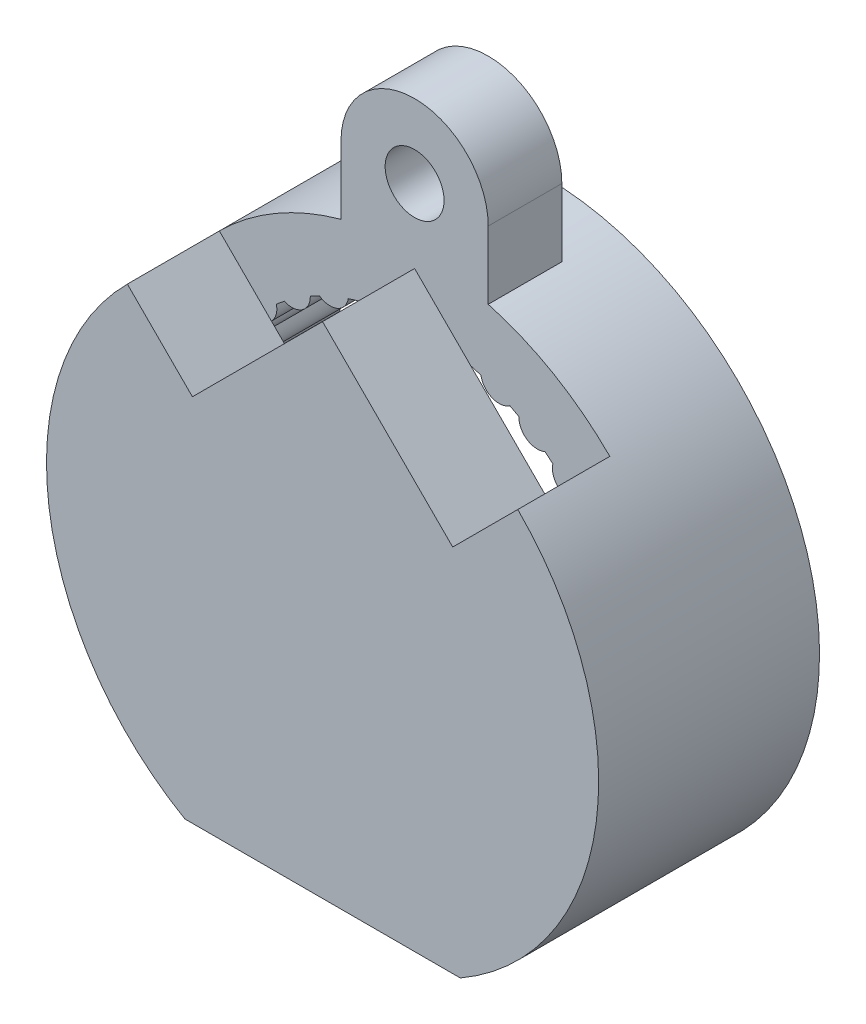
from build123d import *

# Parameters (mm, degrees)
SKETCH1_R               = 1
BOSS_EXTRUDE1_DEPTH     = 3.5
BOSS_EXTRUDE1_2_DEPTH   = 3.5
BOSS_EXTRUDE1_3_DEPTH   = 3.5
BOSS_EXTRUDE1_4_DEPTH   = 3.5
BOSS_EXTRUDE1_5_DEPTH   = 3.5
BOSS_EXTRUDE1_6_DEPTH   = 3.5
BOSS_EXTRUDE1_7_DEPTH   = 3.5
BOSS_EXTRUDE1_8_DEPTH   = 3.5
BOSS_EXTRUDE1_9_DEPTH   = 3.5
BOSS_EXTRUDE1_10_DEPTH  = 3.5
BOSS_EXTRUDE1_11_DEPTH  = 3.5
BOSS_EXTRUDE1_12_DEPTH  = 3.5
BOSS_EXTRUDE1_13_DEPTH  = 3.5
BOSS_EXTRUDE1_14_DEPTH  = 3.5
BOSS_EXTRUDE1_15_DEPTH  = 3.5
BOSS_EXTRUDE1_16_DEPTH  = 3.5
BOSS_EXTRUDE1_17_DEPTH  = 3.5
BOSS_EXTRUDE1_18_DEPTH  = 3.5
BOSS_EXTRUDE1_19_DEPTH  = 3.5
BOSS_EXTRUDE1_20_DEPTH  = 3.5
BOSS_EXTRUDE1_21_DEPTH  = 3.5
BOSS_EXTRUDE1_22_DEPTH  = 3.5
BOSS_EXTRUDE1_23_DEPTH  = 3.5
BOSS_EXTRUDE1_24_DEPTH  = 3.5
BOSS_EXTRUDE1_25_DEPTH  = 3.5
BOSS_EXTRUDE1_26_DEPTH  = 3.5
BOSS_EXTRUDE1_27_DEPTH  = 3.5
BOSS_EXTRUDE1_28_DEPTH  = 3.5
BOSS_EXTRUDE1_29_DEPTH  = 3.5
BOSS_EXTRUDE1_30_DEPTH  = 3.5
BOSS_EXTRUDE1_31_DEPTH  = 3.5
BOSS_EXTRUDE1_32_DEPTH  = 3.5
SKETCH2_R               = 15
SKETCH2_R_2             = 11.5
BOSS_EXTRUDE2_DEPTH     = 3.5
BOSS_EXTRUDE5_START     = -7
SKETCH3_R               = 1.6
BOSS_EXTRUDE5_DEPTH     = 4
BOSS_EXTRUDE4_DEPTH     = 5
CUT_EXTRUDE1_DEPTH      = 30.311765556
CUT_EXTRUDE1_DEPTH_BACK = 30.311765556
BOSS_EXTRUDE6_DEPTH     = 5


with BuildPart() as part:
    # Sketch1 → Boss-Extrude1 (new, symmetric)
    with BuildSketch(Plane.XY):
        with Locations((12, 0)):
            Circle(SKETCH1_R)
    extrude(amount=BOSS_EXTRUDE1_DEPTH, both=True)



with BuildPart() as body_2:
    # Sketch1 → Boss-Extrude1 2 (new, symmetric)
    with BuildSketch(Plane.XY):
        with Locations((11.769423365, -2.341083864)):
            Circle(SKETCH1_R)
    extrude(amount=BOSS_EXTRUDE1_2_DEPTH, both=True)


with BuildPart() as body_3:
    # Sketch1 → Boss-Extrude1 3 (new, symmetric)
    with BuildSketch(Plane.XY):
        with Locations((11.08655439, -4.592201188)):
            Circle(SKETCH1_R)
    extrude(amount=BOSS_EXTRUDE1_3_DEPTH, both=True)


with BuildPart() as body_4:
    # Sketch1 → Boss-Extrude1 4 (new, symmetric)
    with BuildSketch(Plane.XY):
        with Locations((9.977635348, -6.666842796)):
            Circle(SKETCH1_R)
    extrude(amount=BOSS_EXTRUDE1_4_DEPTH, both=True)


with BuildPart() as body_5:
    # Sketch1 → Boss-Extrude1 5 (new, symmetric)
    with BuildSketch(Plane.XY):
        with Locations((8.485281374, -8.485281374)):
            Circle(SKETCH1_R)
    extrude(amount=BOSS_EXTRUDE1_5_DEPTH, both=True)


with BuildPart() as body_6:
    # Sketch1 → Boss-Extrude1 6 (new, symmetric)
    with BuildSketch(Plane.XY):
        with Locations((6.666842796, -9.977635348)):
            Circle(SKETCH1_R)
    extrude(amount=BOSS_EXTRUDE1_6_DEPTH, both=True)


with BuildPart() as body_7:
    # Sketch1 → Boss-Extrude1 7 (new, symmetric)
    with BuildSketch(Plane.XY):
        with Locations((4.592201188, -11.08655439)):
            Circle(SKETCH1_R)
    extrude(amount=BOSS_EXTRUDE1_7_DEPTH, both=True)


with BuildPart() as body_8:
    # Sketch1 → Boss-Extrude1 8 (new, symmetric)
    with BuildSketch(Plane.XY):
        with Locations((2.341083864, -11.769423365)):
            Circle(SKETCH1_R)
    extrude(amount=BOSS_EXTRUDE1_8_DEPTH, both=True)


with BuildPart() as body_9:
    # Sketch1 → Boss-Extrude1 9 (new, symmetric)
    with BuildSketch(Plane.XY):
        with Locations((0, -12)):
            Circle(SKETCH1_R)
    extrude(amount=BOSS_EXTRUDE1_9_DEPTH, both=True)


with BuildPart() as body_10:
    # Sketch1 → Boss-Extrude1 10 (new, symmetric)
    with BuildSketch(Plane.XY):
        with Locations((-2.341083864, -11.769423365)):
            Circle(SKETCH1_R)
    extrude(amount=BOSS_EXTRUDE1_10_DEPTH, both=True)


with BuildPart() as body_11:
    # Sketch1 → Boss-Extrude1 11 (new, symmetric)
    with BuildSketch(Plane.XY):
        with Locations((-4.592201188, -11.08655439)):
            Circle(SKETCH1_R)
    extrude(amount=BOSS_EXTRUDE1_11_DEPTH, both=True)


with BuildPart() as body_12:
    # Sketch1 → Boss-Extrude1 12 (new, symmetric)
    with BuildSketch(Plane.XY):
        with Locations((-6.666842796, -9.977635348)):
            Circle(SKETCH1_R)
    extrude(amount=BOSS_EXTRUDE1_12_DEPTH, both=True)


with BuildPart() as body_13:
    # Sketch1 → Boss-Extrude1 13 (new, symmetric)
    with BuildSketch(Plane.XY):
        with Locations((-8.485281374, -8.485281374)):
            Circle(SKETCH1_R)
    extrude(amount=BOSS_EXTRUDE1_13_DEPTH, both=True)


with BuildPart() as body_14:
    # Sketch1 → Boss-Extrude1 14 (new, symmetric)
    with BuildSketch(Plane.XY):
        with Locations((-9.977635348, -6.666842796)):
            Circle(SKETCH1_R)
    extrude(amount=BOSS_EXTRUDE1_14_DEPTH, both=True)


with BuildPart() as body_15:
    # Sketch1 → Boss-Extrude1 15 (new, symmetric)
    with BuildSketch(Plane.XY):
        with Locations((-11.08655439, -4.592201188)):
            Circle(SKETCH1_R)
    extrude(amount=BOSS_EXTRUDE1_15_DEPTH, both=True)


with BuildPart() as body_16:
    # Sketch1 → Boss-Extrude1 16 (new, symmetric)
    with BuildSketch(Plane.XY):
        with Locations((-11.769423365, -2.341083864)):
            Circle(SKETCH1_R)
    extrude(amount=BOSS_EXTRUDE1_16_DEPTH, both=True)


with BuildPart() as body_17:
    # Sketch1 → Boss-Extrude1 17 (new, symmetric)
    with BuildSketch(Plane.XY):
        with Locations((-12, 0)):
            Circle(SKETCH1_R)
    extrude(amount=BOSS_EXTRUDE1_17_DEPTH, both=True)


with BuildPart() as body_18:
    # Sketch1 → Boss-Extrude1 18 (new, symmetric)
    with BuildSketch(Plane.XY):
        with Locations((-11.769423365, 2.341083864)):
            Circle(SKETCH1_R)
    extrude(amount=BOSS_EXTRUDE1_18_DEPTH, both=True)


with BuildPart() as body_19:
    # Sketch1 → Boss-Extrude1 19 (new, symmetric)
    with BuildSketch(Plane.XY):
        with Locations((-11.08655439, 4.592201188)):
            Circle(SKETCH1_R)
    extrude(amount=BOSS_EXTRUDE1_19_DEPTH, both=True)


with BuildPart() as body_20:
    # Sketch1 → Boss-Extrude1 20 (new, symmetric)
    with BuildSketch(Plane.XY):
        with Locations((-9.977635348, 6.666842796)):
            Circle(SKETCH1_R)
    extrude(amount=BOSS_EXTRUDE1_20_DEPTH, both=True)


with BuildPart() as body_21:
    # Sketch1 → Boss-Extrude1 21 (new, symmetric)
    with BuildSketch(Plane.XY):
        with Locations((-8.485281374, 8.485281374)):
            Circle(SKETCH1_R)
    extrude(amount=BOSS_EXTRUDE1_21_DEPTH, both=True)


with BuildPart() as body_22:
    # Sketch1 → Boss-Extrude1 22 (new, symmetric)
    with BuildSketch(Plane.XY):
        with Locations((-6.666842796, 9.977635348)):
            Circle(SKETCH1_R)
    extrude(amount=BOSS_EXTRUDE1_22_DEPTH, both=True)


with BuildPart() as body_23:
    # Sketch1 → Boss-Extrude1 23 (new, symmetric)
    with BuildSketch(Plane.XY):
        with Locations((-4.592201188, 11.08655439)):
            Circle(SKETCH1_R)
    extrude(amount=BOSS_EXTRUDE1_23_DEPTH, both=True)


with BuildPart() as body_24:
    # Sketch1 → Boss-Extrude1 24 (new, symmetric)
    with BuildSketch(Plane.XY):
        with Locations((-2.341083864, 11.769423365)):
            Circle(SKETCH1_R)
    extrude(amount=BOSS_EXTRUDE1_24_DEPTH, both=True)


with BuildPart() as body_25:
    # Sketch1 → Boss-Extrude1 25 (new, symmetric)
    with BuildSketch(Plane.XY):
        with Locations((0, 12)):
            Circle(SKETCH1_R)
    extrude(amount=BOSS_EXTRUDE1_25_DEPTH, both=True)


with BuildPart() as body_26:
    # Sketch1 → Boss-Extrude1 26 (new, symmetric)
    with BuildSketch(Plane.XY):
        with Locations((2.341083864, 11.769423365)):
            Circle(SKETCH1_R)
    extrude(amount=BOSS_EXTRUDE1_26_DEPTH, both=True)


with BuildPart() as body_27:
    # Sketch1 → Boss-Extrude1 27 (new, symmetric)
    with BuildSketch(Plane.XY):
        with Locations((4.592201188, 11.08655439)):
            Circle(SKETCH1_R)
    extrude(amount=BOSS_EXTRUDE1_27_DEPTH, both=True)


with BuildPart() as body_28:
    # Sketch1 → Boss-Extrude1 28 (new, symmetric)
    with BuildSketch(Plane.XY):
        with Locations((6.666842796, 9.977635348)):
            Circle(SKETCH1_R)
    extrude(amount=BOSS_EXTRUDE1_28_DEPTH, both=True)


with BuildPart() as body_29:
    # Sketch1 → Boss-Extrude1 29 (new, symmetric)
    with BuildSketch(Plane.XY):
        with Locations((8.485281374, 8.485281374)):
            Circle(SKETCH1_R)
    extrude(amount=BOSS_EXTRUDE1_29_DEPTH, both=True)


with BuildPart() as body_30:
    # Sketch1 → Boss-Extrude1 30 (new, symmetric)
    with BuildSketch(Plane.XY):
        with Locations((9.977635348, 6.666842796)):
            Circle(SKETCH1_R)
    extrude(amount=BOSS_EXTRUDE1_30_DEPTH, both=True)


with BuildPart() as body_31:
    # Sketch1 → Boss-Extrude1 31 (new, symmetric)
    with BuildSketch(Plane.XY):
        with Locations((11.08655439, 4.592201188)):
            Circle(SKETCH1_R)
    extrude(amount=BOSS_EXTRUDE1_31_DEPTH, both=True)


with BuildPart() as body_32:
    # Sketch1 → Boss-Extrude1 32 (new, symmetric)
    with BuildSketch(Plane.XY):
        with Locations((11.769423365, 2.341083864)):
            Circle(SKETCH1_R)
    extrude(amount=BOSS_EXTRUDE1_32_DEPTH, both=True)


with BuildPart() as part_1:
    add(part.part)

    add(body_2.part)  # Boss-Extrude2 merges body 2

    add(body_3.part)  # Boss-Extrude2 merges body 3

    add(body_4.part)  # Boss-Extrude2 merges body 4

    add(body_5.part)  # Boss-Extrude2 merges body 5

    add(body_6.part)  # Boss-Extrude2 merges body 6

    add(body_7.part)  # Boss-Extrude2 merges body 7

    add(body_8.part)  # Boss-Extrude2 merges body 8

    add(body_9.part)  # Boss-Extrude2 merges body 9

    add(body_10.part)  # Boss-Extrude2 merges body 10

    add(body_11.part)  # Boss-Extrude2 merges body 11

    add(body_12.part)  # Boss-Extrude2 merges body 12

    add(body_13.part)  # Boss-Extrude2 merges body 13

    add(body_14.part)  # Boss-Extrude2 merges body 14

    add(body_15.part)  # Boss-Extrude2 merges body 15

    add(body_16.part)  # Boss-Extrude2 merges body 16

    add(body_17.part)  # Boss-Extrude2 merges body 17

    add(body_18.part)  # Boss-Extrude2 merges body 18

    add(body_19.part)  # Boss-Extrude2 merges body 19

    add(body_20.part)  # Boss-Extrude2 merges body 20

    add(body_21.part)  # Boss-Extrude2 merges body 21

    add(body_22.part)  # Boss-Extrude2 merges body 22

    add(body_23.part)  # Boss-Extrude2 merges body 23

    add(body_24.part)  # Boss-Extrude2 merges body 24

    add(body_25.part)  # Boss-Extrude2 merges body 25

    add(body_26.part)  # Boss-Extrude2 merges body 26

    add(body_27.part)  # Boss-Extrude2 merges body 27

    add(body_28.part)  # Boss-Extrude2 merges body 28

    add(body_29.part)  # Boss-Extrude2 merges body 29

    add(body_30.part)  # Boss-Extrude2 merges body 30

    add(body_31.part)  # Boss-Extrude2 merges body 31

    add(body_32.part)  # Boss-Extrude2 merges body 32
    # Sketch2 → Boss-Extrude2 (add, symmetric)
    with BuildSketch(Plane.XY):
        Circle(SKETCH2_R)
        Circle(SKETCH2_R_2, mode=Mode.SUBTRACT)
    extrude(amount=BOSS_EXTRUDE2_DEPTH, both=True)

    # Sketch3 → Boss-Extrude5 (add)
    with BuildSketch(Plane(origin=(0, 0, -3.5), x_dir=(-1, 0, 0), z_dir=(0, 0, -1)).offset(BOSS_EXTRUDE5_START)):
        with BuildLine():
            Line((-4, 14.456832295), (-4, 18.14))
            ThreePointArc((-4, 18.14), (0, 22.14), (4, 18.14))
            Line((4, 18.14), (4, 14.456832295))
            ThreePointArc((4, 14.456832295), (0, 15), (-4, 14.456832295))
        make_face()
        with Locations(Location((0, 18.14, 0), (0, 0, 180))):
            Circle(SKETCH3_R, mode=Mode.SUBTRACT)
    extrude(amount=BOSS_EXTRUDE5_DEPTH)

    # Sketch4 → Boss-Extrude4 (add)
    with BuildSketch(Plane.XY.offset(3.5)):
        with BuildLine():
            Line((-7.778174593, 6.363961031), (0, 14.142135624))
            Line((0, 14.142135624), (7.778174593, 6.363961031))
            ThreePointArc((7.778174593, 6.363961031), (0, -15), (-7.778174593, 6.363961031))
        make_face()
    extrude(amount=BOSS_EXTRUDE4_DEPTH)

    # Sketch5 → Cut-Extrude1 (cut, two sides: drawn at the far end of the back side and taken through both)
    with BuildSketch(Plane.XY.offset(8.5).offset(-CUT_EXTRUDE1_DEPTH_BACK)):
        with BuildLine():
            Line((-7.483314774, -13), (7.483314774, -13))
            ThreePointArc((7.483314774, -13), (3.872983346, -14.491376746), (0, -15))
            ThreePointArc((0, -15), (-3.872983346, -14.491376746), (-7.483314774, -13))
        make_face()
    extrude(amount=CUT_EXTRUDE1_DEPTH + CUT_EXTRUDE1_DEPTH_BACK, mode=Mode.SUBTRACT)

    # Sketch6 → Boss-Extrude6 (add)
    with BuildSketch(Plane.XY.offset(3.5)):
        with BuildLine():
            Line((7.071067812, 7.071067812), (10.606601718, 10.606601718))
            ThreePointArc((10.606601718, 10.606601718), (14.870412934, -1.96743975), (7.483314774, -13))
            Line((7.483314774, -13), (6.662707091, -13))
            ThreePointArc((6.662707091, -13), (12.077893552, -3.597834685), (7.778174593, 6.363961031))
            Line((7.778174593, 6.363961031), (7.071067812, 7.071067812))
        make_face()
        with BuildLine():
            Line((-10.606601718, 10.606601718), (-7.071067812, 7.071067812))
            Line((-7.071067812, 7.071067812), (-7.778174593, 6.363961031))
            ThreePointArc((-7.778174593, 6.363961031), (-12.077893552, -3.597834685), (-6.662707091, -13))
            Line((-6.662707091, -13), (-7.483314774, -13))
            ThreePointArc((-7.483314774, -13), (-14.870412934, -1.96743975), (-10.606601718, 10.606601718))
        make_face()
    extrude(amount=BOSS_EXTRUDE6_DEPTH)


solid = part_1.part
